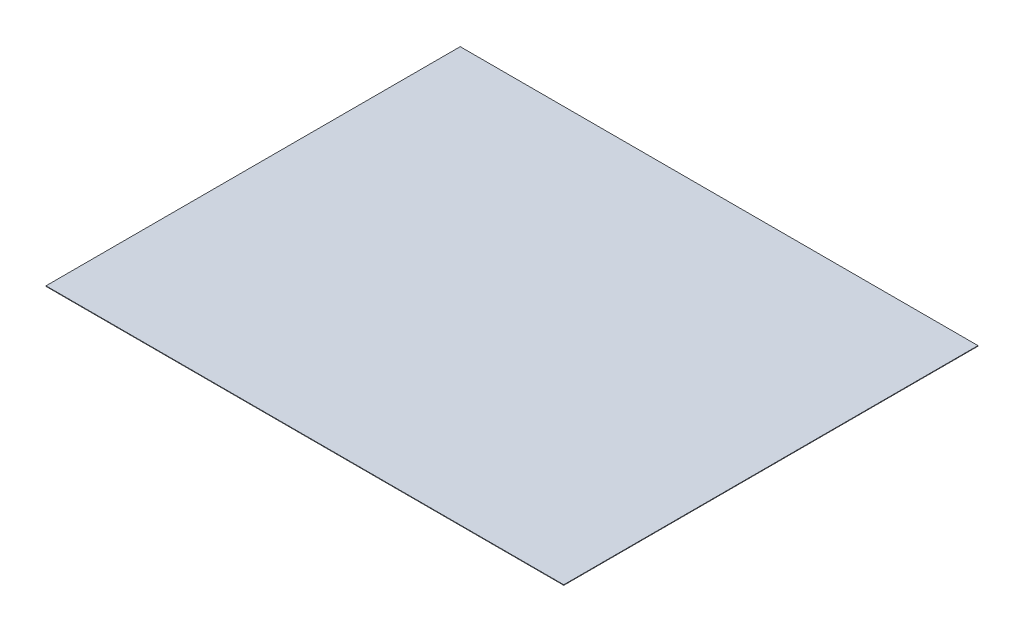
from build123d import *

# Parameters (mm, degrees)
SKETCH_1_W      = 100
SKETCH_1_H      = 80
EXTRUDE_1_DEPTH = 0.1


with BuildPart() as part:
    # 草图1 → 凸台-拉伸1 (new body)
    with BuildSketch(Plane(origin=(0, 0, 0), x_dir=(1, 0, 0), z_dir=(0, 1, 0))):
        Rectangle(SKETCH_1_W, SKETCH_1_H)
    extrude(amount=EXTRUDE_1_DEPTH)


solid = part.part
